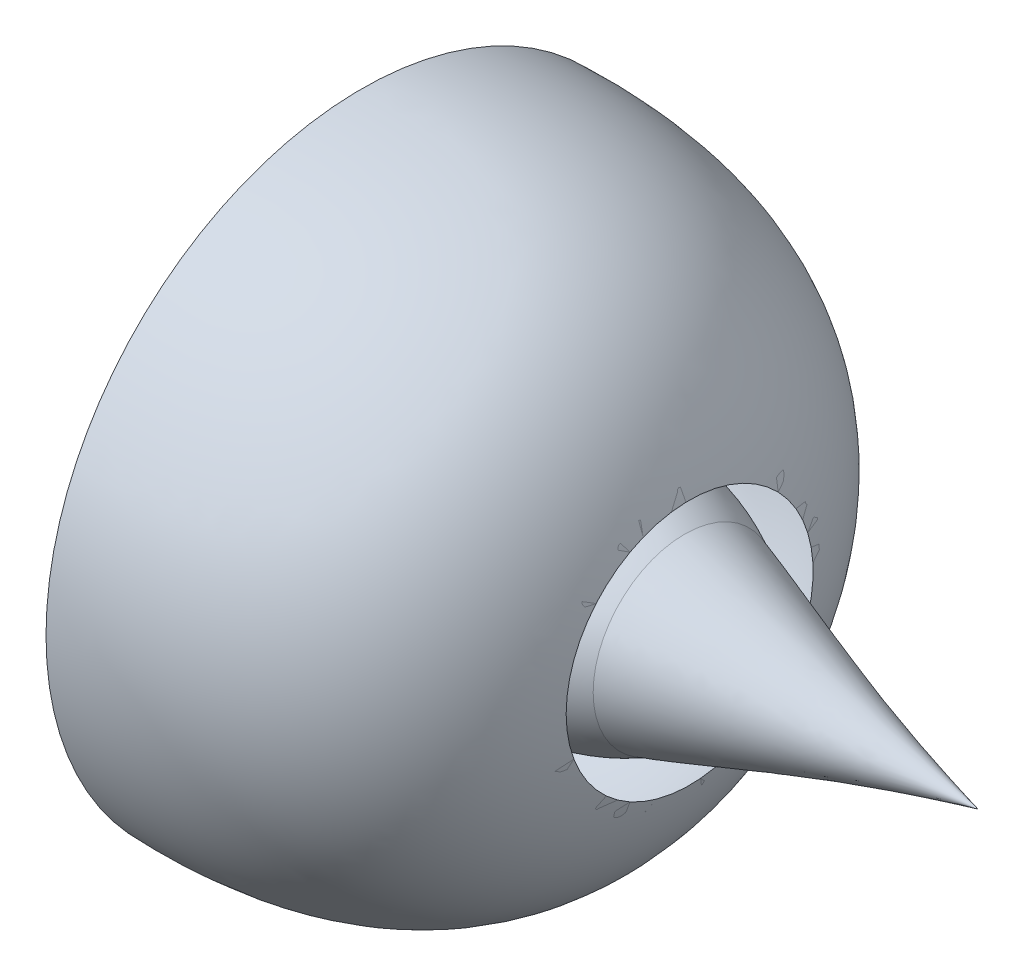
from build123d import *


with BuildPart() as part:
    # Sketch1 → Revolve1 (revolve)
    with BuildSketch(Plane.XY):
        with BuildLine():
            add(Edge.make_bspline(
                [(-228.654742719, 84.367004813), (-289.460151277, 57.143781761), (-324.102934747, 0)],
                knots=[0, 0, 0, 1, 1, 1], degree=2))
            Line((-324.102934747, 0), (244.948974278, 0))
            add(Edge.make_bspline(
                [(-25.949126387, 84.367004813), (-18.957259862, 82.095296942), (-8.869910721, 78.816851338), (3.638273592, 74.590006145), (11.322220666, 71.966168673), (17.876186843, 69.708836629), (23.797862943, 67.658123054), (29.306744321, 65.743296026), (34.525177517, 63.925477625), (39.530205643, 62.180322475), (44.3743349, 60.49140124), (49.09540116, 58.846990509), (53.721848308, 57.238380904), (58.27578855, 55.658892935), (62.774891733, 54.103272173), (67.233609611, 52.567297708), (71.664001234, 51.047518792), (76.076307919, 49.541071737), (80.479364995, 48.045549069), (84.880903762, 46.558903807), (89.287777555, 45.079377994), (93.706134095, 43.605448381), (98.141549043, 42.135784493), (102.599131022, 40.669215802), (107.083605307, 39.204705695), (111.599381336, 37.74133063), (116.150607807, 36.278263223), (120.741218117, 34.814758452), (125.374968237, 33.350142264), (130.055468575, 31.883802125), (134.786211056, 30.415179106), (139.570592337, 28.943761213), (144.411933912, 27.469077746), (149.313499658, 25.99069448), (154.278511323, 24.508209542), (159.310162291, 23.021249863), (164.411629949, 21.5294681), (169.586086906, 20.032539969), (174.836711247, 18.53016192), (180.166696019, 17.022049086), (185.579258067, 15.507933513), (191.077646344, 13.987562514), (196.665149873, 12.460697503), (202.345105103, 10.927111864), (208.12090407, 9.386593251), (213.995998332, 7.838929552), (219.973918235, 6.283957951), (226.058232992, 4.721372994), (232.25273699, 3.151457593), (238.560769717, 1.572280042), (242.807039438, 0.527178078), (244.948974278, 0)],
                knots=[0.000866284, 0.000866284, 0.000866284, 0.000866284, 0.078495151, 0.112866788, 0.140282912, 0.164233954, 0.186063245, 0.206456306, 0.225818921, 0.244414938, 0.262427561, 0.279990385, 0.297204624, 0.31414937, 0.330888045, 0.347472637, 0.363946582, 0.380346794, 0.39670512, 0.413049419, 0.429404369, 0.445792089, 0.462232615, 0.478744281, 0.495344021, 0.512047615, 0.528869888, 0.54582487, 0.562925943, 0.580185948, 0.597617287, 0.615232008, 0.633041878, 0.651058443, 0.669293089, 0.687757091, 0.706461656, 0.725417962, 0.744637202, 0.764130612, 0.783909503, 0.803985296, 0.824369544, 0.845073966, 0.866110467, 0.887491166, 0.909228425, 0.931334866, 0.953823401, 0.976707258, 1, 1, 1, 1], degree=3))
            add(Edge.make_bspline(
                [(-25.949126387, 84.367004813), (-87.277374705, 117.089551667), (-167.798353056, 119.164195992), (-228.654742719, 84.367004813)],
                knots=[0, 0, 0, 0, 1, 1, 1, 1], degree=3))
        make_face()
    revolve(axis=Axis((-324.102934747, 0, 0), (1, 0, 0)))


with BuildPart() as body_2:
    # Sketch2 → Revolve2 (revolve)
    with BuildSketch(Plane.XY):
        with BuildLine():
            Line((-324.102934747, 291.340519346), (-324.102934747, 266.867099032))
            add(Edge.make_bspline(
                [(-21.261264031, 113.998473668), (-60.733421994, 238.454880091), (-209.90225691, 277.366784471), (-324.102934747, 266.867099032)],
                knots=[0, 0, 0, 0, 1, 1, 1, 1], degree=3))
            add(Edge.make_bspline(
                [(-21.261264031, 113.998473668), (-79.430361908, 299.119564476), (-324.102934747, 291.340519346)],
                knots=[0, 0, 0, 1, 1, 1], degree=2))
        make_face()
    revolve(axis=Axis((-324.102934747, 0, 0), (1, 0, 0)))


solid = Compound([part.part, body_2.part])
